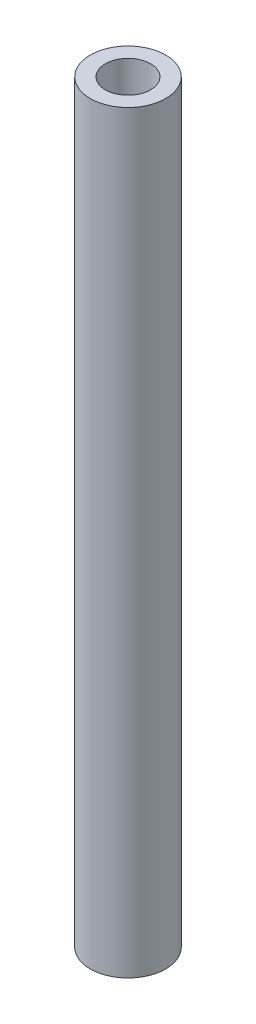
from build123d import *

# Parameters (mm, degrees)
SKETCH1_R                      = 2.5
BOSS_EXTRUDE1_DEPTH            = 50
F_31_0_12_DIAMETER_HOLE2_D     = 3.000000096
F_31_0_12_DIAMETER_HOLE2_DEPTH = 10
F_31_0_12_DIAMETER_HOLE2_TIP   = 0.901290957


with BuildPart() as part:
    # Sketch1 → Boss-Extrude1 (new body)
    with BuildSketch(Plane(origin=(0, 0, 0), x_dir=(1, 0, 0), z_dir=(0, 1, 0))):
        with Locations(Location((0, 0, 0), (0, 0, 270))):
            Circle(SKETCH1_R)
    extrude(amount=BOSS_EXTRUDE1_DEPTH)

    # #31 (0.12) Diameter Hole2
    with Locations(Plane(origin=(0, 50, 0), x_dir=(1, 0, 0), z_dir=(0, 1, 0))):
        with Locations((0, 0)):
            Hole(F_31_0_12_DIAMETER_HOLE2_D / 2, depth=F_31_0_12_DIAMETER_HOLE2_DEPTH)
            with Locations((0, 0, -(F_31_0_12_DIAMETER_HOLE2_DEPTH + F_31_0_12_DIAMETER_HOLE2_TIP / 2))):  # 118° drill point
                Cone(0, F_31_0_12_DIAMETER_HOLE2_D / 2, F_31_0_12_DIAMETER_HOLE2_TIP, mode=Mode.SUBTRACT)


solid = part.part
